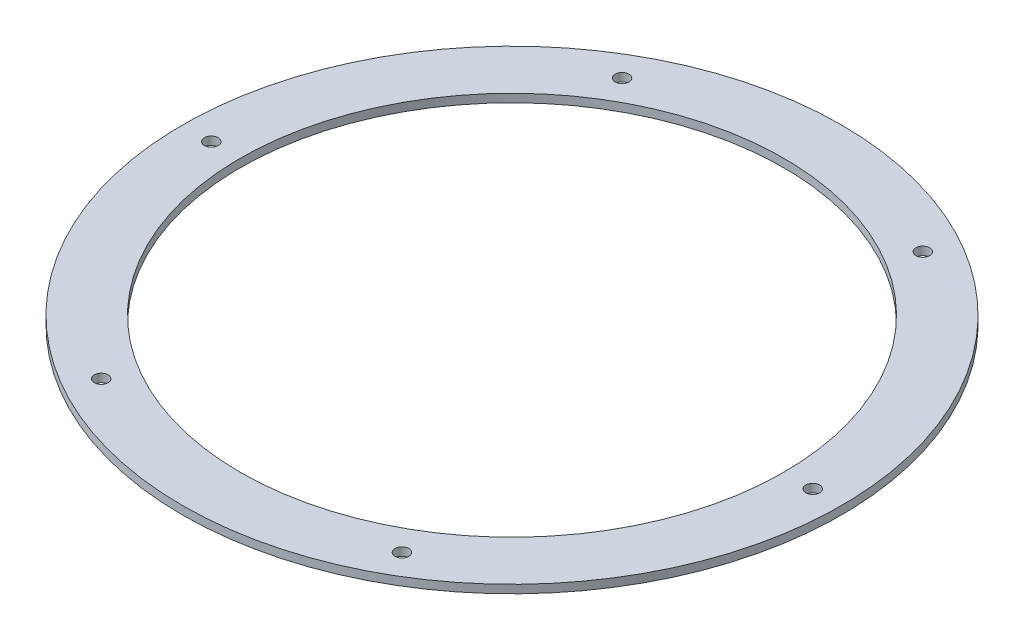
from build123d import *

# Parameters (mm, degrees)
SKETCH1_R           = 120
SKETCH1_R_2         = 99
SKETCH1_R_3         = 2.5
BOSS_EXTRUDE1_DEPTH = 3


with BuildPart() as part:
    # Sketch1 → Boss-Extrude1 (new body)
    with BuildSketch(Plane(origin=(0, 0, 0), x_dir=(1, 0, 0), z_dir=(0, 1, 0))):
        with Locations(Location((0, 0, 0), (0, 0, 270))):
            Circle(SKETCH1_R)
        with Locations(Location((0, 0, 0), (0, 0, 270))):
            Circle(SKETCH1_R_2, mode=Mode.SUBTRACT)
        with Locations(Location((-109.5, 0, 0), (0, 0, 270))):
            Circle(SKETCH1_R_3, mode=Mode.SUBTRACT)
        with Locations(Location((-54.75, 94.829781714, 0), (0, 0, 270))):
            Circle(SKETCH1_R_3, mode=Mode.SUBTRACT)
        with Locations(Location((54.75, 94.829781714, 0), (0, 0, 270))):
            Circle(SKETCH1_R_3, mode=Mode.SUBTRACT)
        with Locations(Location((109.5, 0, 0), (0, 0, 270))):
            Circle(SKETCH1_R_3, mode=Mode.SUBTRACT)
        with Locations(Location((54.75, -94.829781714, 0), (0, 0, 270))):
            Circle(SKETCH1_R_3, mode=Mode.SUBTRACT)
        with Locations(Location((-54.75, -94.829781714, 0), (0, 0, 270))):
            Circle(SKETCH1_R_3, mode=Mode.SUBTRACT)
    extrude(amount=BOSS_EXTRUDE1_DEPTH)


solid = part.part
